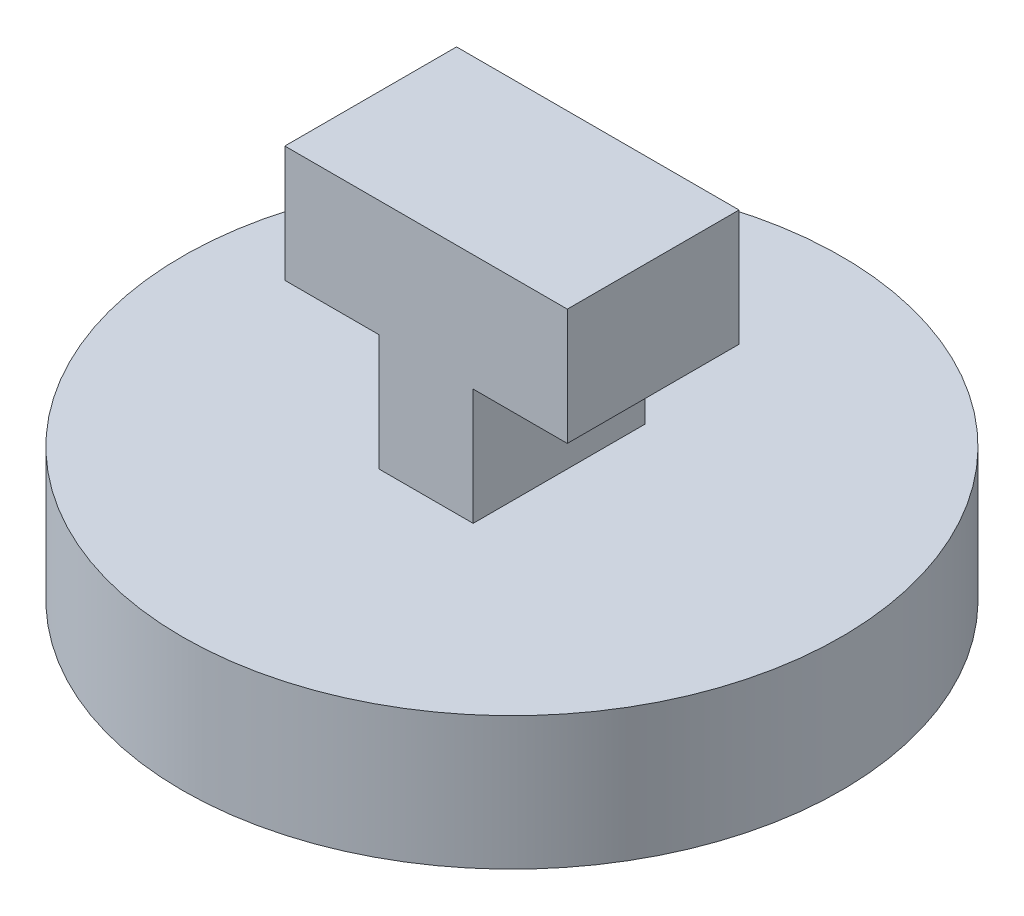
from build123d import *

# Parameters (mm, degrees)
SKETCH2_R                = 5.95
BOSS_EXTRUDE2_DEPTH      = 2.4
BOSS_EXTRUDE3_DEPTH      = 1.55
BOSS_EXTRUDE3_DEPTH_BACK = 1.55


with BuildPart() as part:
    # Sketch2 → Boss-Extrude2 (new body)
    with BuildSketch(Plane(origin=(0, 0, 0), x_dir=(1, 0, 0), z_dir=(0, 1, 0))):
        with Locations(Location((0, 0, 0), (0, 0, 270))):
            Circle(SKETCH2_R)
    extrude(amount=BOSS_EXTRUDE2_DEPTH)

    # Sketch4 → Boss-Extrude3 (add, two sides: drawn at the far end of the back side and taken through both)
    with BuildSketch(Plane.XY.offset(-BOSS_EXTRUDE3_DEPTH_BACK)):
        Polygon((-0.85, 2.4), (-0.85, 4.5), (-2.55, 4.5), (-2.55, 6.6), (2.55, 6.6), (2.55, 4.5), (0.85, 4.5), (0.85, 2.4), align=None)
    extrude(amount=BOSS_EXTRUDE3_DEPTH + BOSS_EXTRUDE3_DEPTH_BACK)


solid = part.part
